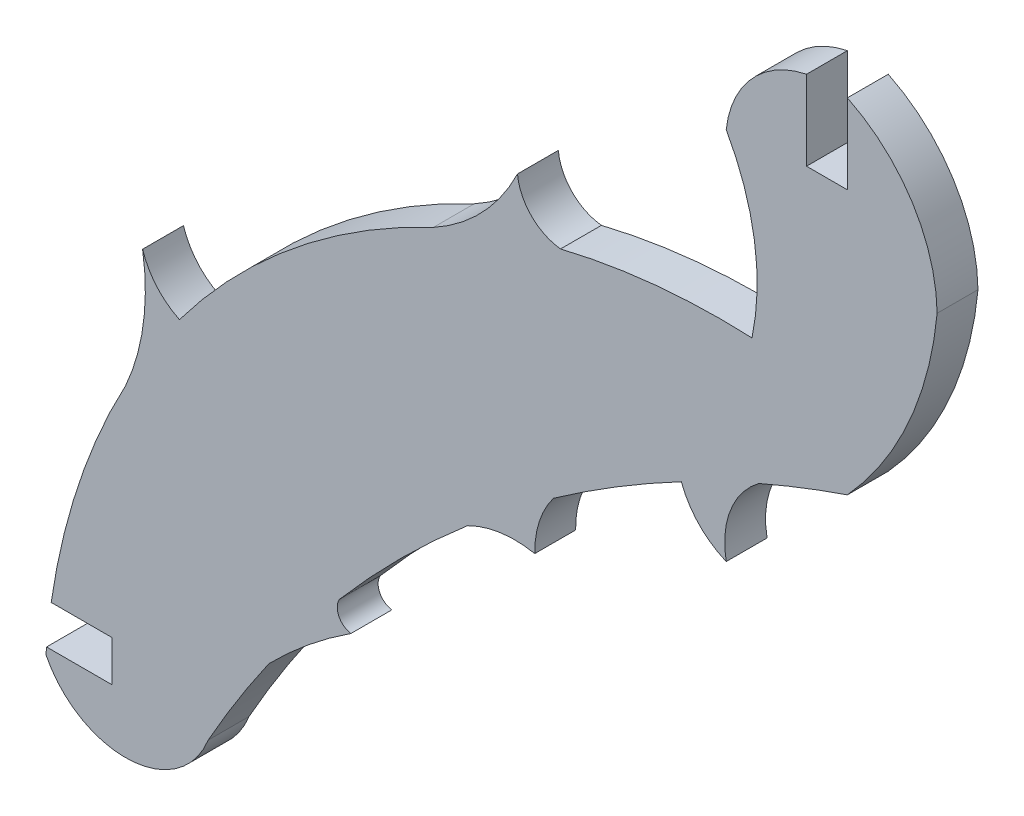
from build123d import *

# Parameters (mm, degrees)
BOSS_EXTRUDE1_DEPTH = 1.524


with BuildPart() as part:
    # Sketch1 → Boss-Extrude1 (new body)
    with BuildSketch(Plane.XY):
        with BuildLine():
            Line((0, -11.304143944), (1.524, -11.304143944))
            Line((1.524, -11.304143944), (1.524, -8.333085901))
            ThreePointArc((1.524, -8.333085901), (3.945438138, -10.501523778), (4.87145261, -13.617287357))
            ThreePointArc((4.87145261, -13.617287357), (3.813444714, -17.660873454), (1.524, -21.157788112))
            ThreePointArc((1.524, -21.157788112), (-0.138732581, -21.765001835), (-1.77540365, -22.4393133))
            ThreePointArc((-1.77540365, -22.4393133), (-2.836636029, -23.830223279), (-2.99560227, -25.572513285))
            ThreePointArc((-2.99560227, -25.572513285), (-4.014612166, -24.876344883), (-4.669334398, -23.830223279))
            ThreePointArc((-4.669334398, -23.830223279), (-7.100142825, -25.212490369), (-9.437186958, -26.747976168))
            ThreePointArc((-9.437186958, -26.747976168), (-9.966611367, -27.75761792), (-10.13579223, -28.885024017))
            ThreePointArc((-10.13579223, -28.885024017), (-11.420458761, -28.850541305), (-12.64562455, -29.238518038))
            ThreePointArc((-12.64562455, -29.238518038), (-15.129726879, -31.532392213), (-17.428294378, -34.012152396))
            ThreePointArc((-17.428294378, -34.012152396), (-17.440615342, -34.566818357), (-16.992461897, -34.893872824))
            ThreePointArc((-16.992461897, -34.893872824), (-18.592932451, -36.063409356), (-20.055394787, -37.401514587))
            ThreePointArc((-20.055394787, -37.401514587), (-21.23200408, -39.175477677), (-22.32048354, -41.004840118))
            ThreePointArc((-22.32048354, -41.004840118), (-25.256637968, -43.106248561), (-28.366018586, -41.270854206))
            ThreePointArc((-28.366018586, -41.270854206), (-28.356027092, -41.137819843), (-28.345332967, -41.004840118))
            Line((-28.345332967, -41.004840118), (-25.899875794, -41.004840118))
            Line((-25.899875794, -41.004840118), (-25.899875794, -39.480840118))
            Line((-25.899875794, -39.480840118), (-28.171982443, -39.480840118))
            ThreePointArc((-28.171982443, -39.480840118), (-27.155881735, -35.169299836), (-25.402070376, -31.10162409))
            ThreePointArc((-25.402070376, -31.10162409), (-24.736304523, -28.780464694), (-24.763169881, -26.365862581))
            ThreePointArc((-24.763169881, -26.365862581), (-24.241136691, -27.302583764), (-23.389289994, -27.953984126))
            ThreePointArc((-23.389289994, -27.953984126), (-19.127839076, -23.515816288), (-13.919621322, -20.239878938))
            ThreePointArc((-13.919621322, -20.239878938), (-12.092421111, -18.838162319), (-10.781391169, -16.944839687))
            ThreePointArc((-10.781391169, -16.944839687), (-10.265088251, -18.039159093), (-9.174768374, -18.563855417))
            ThreePointArc((-9.174768374, -18.563855417), (-5.629295434, -17.960763676), (-2.03410657, -17.86740925))
            ThreePointArc((-2.03410657, -17.86740925), (-1.944710685, -14.656928393), (-2.99560227, -11.621997448))
            ThreePointArc((-2.99560227, -11.621997448), (-2.03410657, -9.489064634), (0, -8.333085901))
            Line((0, -8.333085901), (0, -11.304143944))
        make_face()
    extrude(amount=BOSS_EXTRUDE1_DEPTH)


solid = part.part
